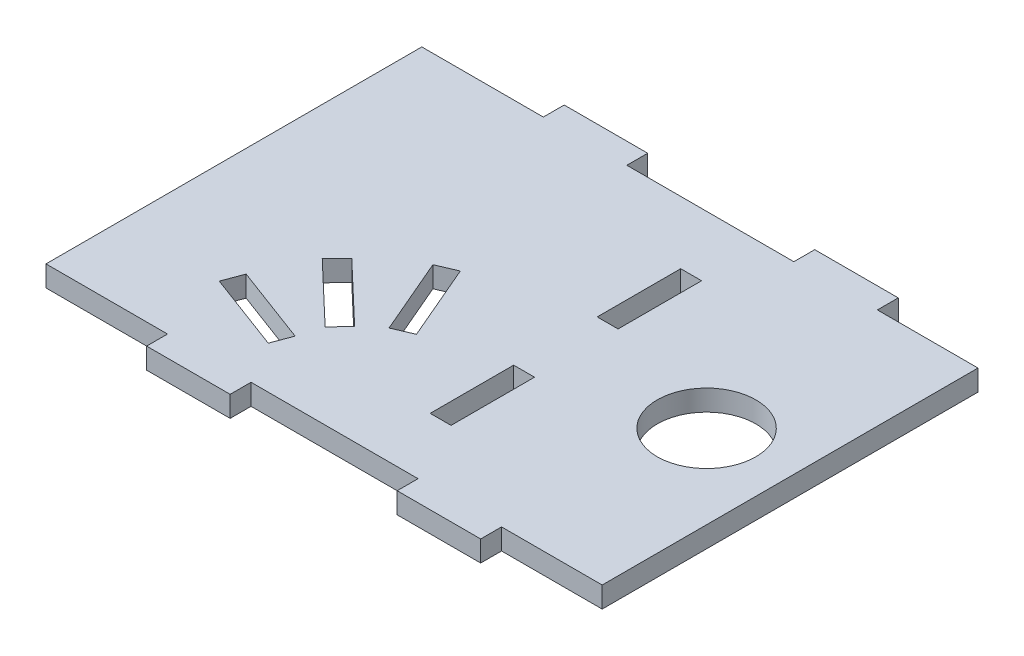
from build123d import *

# Parameters (mm, degrees)
SKETCH1_R           = 7.5
SKETCH1_W           = 3.175
SKETCH1_H           = 12.7
BOSS_EXTRUDE1_DEPTH = 3.175


with BuildPart() as part:
    # Sketch1 → Boss-Extrude1 (new body)
    with BuildSketch(Plane(origin=(0, 0, 0), x_dir=(1, 0, 0), z_dir=(0, 1, 0))):
        Polygon((0, 0), (15.302420881, 0), (15.302420881, -3.175), (28.002420881, -3.175), (28.002420881, 0), (53.402420881, 0), (53.402420881, -3.175), (66.102420881, -3.175), (66.102420881, 0), (81.404841762, 0), (81.404841762, 19.05), (81.404841762, 38.1), (81.404841762, 57.15), (66.102420881, 57.15), (66.102420881, 60.325), (53.402420881, 60.325), (53.402420881, 57.15), (28.002420881, 57.15), (28.002420881, 60.325), (15.302420881, 60.325), (15.302420881, 57.15), (0, 57.15), (-3.175, 57.15), (-3.175, 0), align=None)
        with Locations(Location((68.704841762, 28.575, 0), (0, 0, 270))):
            Circle(SKETCH1_R, mode=Mode.SUBTRACT)
        with Locations((47.3075, 15.875)):
            Rectangle(SKETCH1_W, SKETCH1_H, mode=Mode.SUBTRACT)
        with Locations((47.3075, 41.275)):
            Rectangle(SKETCH1_W, SKETCH1_H, mode=Mode.SUBTRACT)
        Polygon((26.350084324, 29.310366676), (31.353146576, 17.637347868), (34.271401278, 18.888113431), (29.268339026, 30.561132239), align=None, mode=Mode.SUBTRACT)
        Polygon((17.153101684, 21.678911781), (26.350084324, 12.920743576), (28.539626376, 15.219989236), (19.342643735, 23.978157441), align=None, mode=Mode.SUBTRACT)
        Polygon((12.270885661, 10.90317475), (13.382794097, 13.87710895), (25.2785309, 9.429475209), (24.166622465, 6.455541008), align=None, mode=Mode.SUBTRACT)
    extrude(amount=BOSS_EXTRUDE1_DEPTH)


solid = part.part
